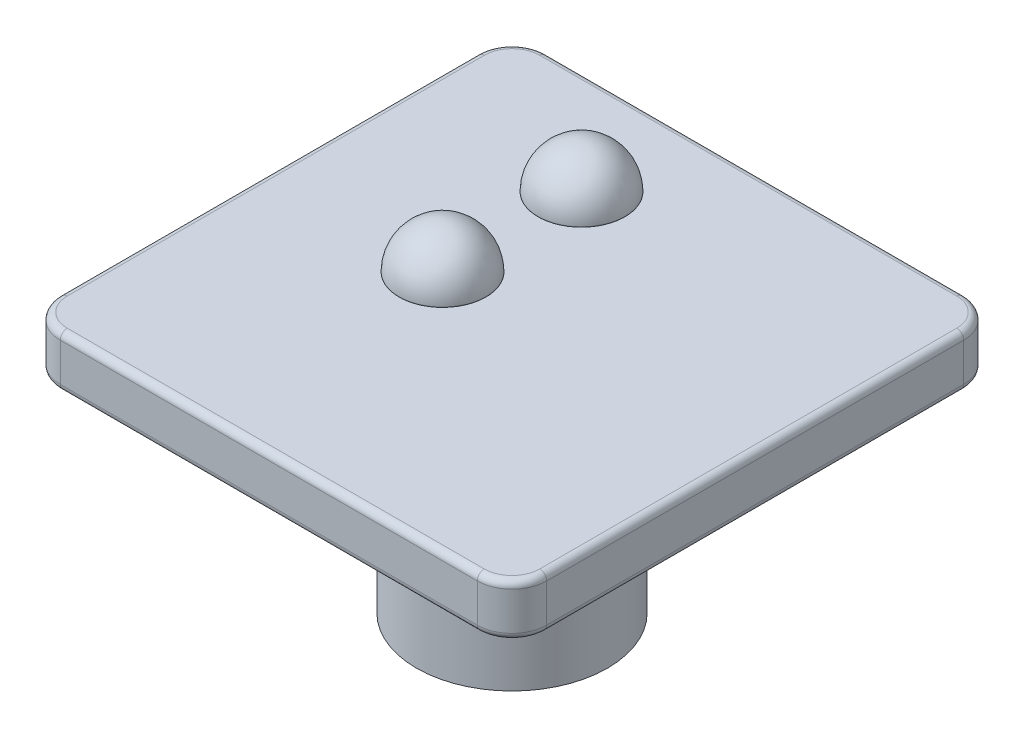
from build123d import *

# Parameters (mm, degrees)
BOSS_EXTRUDE1_DEPTH = 1.5
SKETCH2_R           = 2.75
BOSS_EXTRUDE2_DEPTH = 6
SKETCH3_W           = 1.1
SKETCH3_H           = 1.45
SKETCH3_W_2         = 1.45
SKETCH3_H_2         = 1.1
CUT_EXTRUDE1_DEPTH  = 6
CHAMFER1_SIZE       = 0.3
FILLET1_R           = 1
SKETCH4_R           = 1.25
BOSS_EXTRUDE3_DEPTH = 0.01
DOME1_FACE_RADIUS   = 1.25
DOME1_HEIGHT        = 1.25
DOME3_FACE_RADIUS   = 1.25
DOME3_HEIGHT        = 1.25
FILLET3_R           = 0.2


with BuildPart() as part:
    # Sketch1 → Boss-Extrude1 (new body)
    with BuildSketch(Plane(origin=(0, 0, 0), x_dir=(1, 0, 0), z_dir=(0, 1, 0))):
        with BuildLine():
            Line((-7.324675649, 4.396717546), (4.675324351, 4.396717546))
            ThreePointArc((4.675324351, 4.396717546), (5.382431132, 4.103824327), (5.675324351, 3.396717546))
            Line((5.675324351, 3.396717546), (5.675324351, -8.603282454))
            ThreePointArc((5.675324351, -8.603282454), (5.382431132, -9.310389235), (4.675324351, -9.603282454))
            Line((4.675324351, -9.603282454), (-7.324675649, -9.603282454))
            ThreePointArc((-7.324675649, -9.603282454), (-8.03178243, -9.310389235), (-8.324675649, -8.603282454))
            Line((-8.324675649, -8.603282454), (-8.324675649, 3.396717546))
            ThreePointArc((-8.324675649, 3.396717546), (-8.03178243, 4.103824327), (-7.324675649, 4.396717546))
        make_face()
    extrude(amount=BOSS_EXTRUDE1_DEPTH)

    # Sketch2 → Boss-Extrude2 (add)
    with BuildSketch(Plane.XZ):
        with Locations(Location((-1.324675649, 2.603282454, 0), (0, 0, 270))):
            Circle(SKETCH2_R)
    extrude(amount=BOSS_EXTRUDE2_DEPTH)

    # Sketch3 → Cut-Extrude1 (cut)
    with BuildSketch(Plane.XZ.offset(6)):
        with Locations((-1.324675649, 3.878282454)):
            Rectangle(SKETCH3_W, SKETCH3_H)
        with Locations((-0.049675649, 2.603282454)):
            Rectangle(SKETCH3_W_2, SKETCH3_H_2)
        with Locations((-1.324675649, 2.603282454)):
            Rectangle(SKETCH3_W, SKETCH3_H_2)
        with Locations((-2.599675649, 2.603282454)):
            Rectangle(SKETCH3_W_2, SKETCH3_H_2)
        with Locations((-1.324675649, 1.328282454)):
            Rectangle(SKETCH3_W, SKETCH3_H)
    extrude(amount=-CUT_EXTRUDE1_DEPTH, mode=Mode.SUBTRACT)

    # Chamfer1
    chamfer1_edges = [part.edges().sort_by_distance(p)[0] for p in [
        (-0.774675649, -6, 3.878282454),
        (-0.049675649, -6, 3.153282454),
        (0.675324351, -6, 2.603282454),
        (-0.774675649, -6, 1.328282454),
        (-2.599675649, -6, 3.153282454),
        (-1.324675649, -6, 4.603282454),
        (-1.874675649, -6, 3.878282454),
        (-3.324675649, -6, 2.603282454),
        (-2.599675649, -6, 2.053282454),
        (-1.874675649, -6, 1.328282454),
        (-1.324675649, -6, 0.603282454),
        (-0.049675649, -6, 2.053282454),
    ]]
    chamfer(chamfer1_edges, length=CHAMFER1_SIZE)

    # Fillet1
    fillet1_edges = [part.edges().sort_by_distance(p)[0] for p in [
        (-1.324675649, 0, 5.353282454),
    ]]
    fillet(fillet1_edges, radius=FILLET1_R)

    # Sketch4 → Boss-Extrude3 (add)
    with BuildSketch(Plane(origin=(0, 1.5, 0), x_dir=(1, 0, 0), z_dir=(0, 1, 0))):
        with Locations(Location((-3.324675649, 1.396717546, 0), (0, 0, 90))):
            Circle(SKETCH4_R)
        with Locations(Location((-3.324675649, -2.603282454, 0), (0, 0, 90))):
            Circle(SKETCH4_R)
    extrude(amount=BOSS_EXTRUDE3_DEPTH)

    # Dome1: a dome of height H over a round flat face of radius A is a cap of a sphere of radius (A * A + H * H) / (2 * H)
    dome1_r = (DOME1_FACE_RADIUS * DOME1_FACE_RADIUS + DOME1_HEIGHT * DOME1_HEIGHT) / (2 * DOME1_HEIGHT)
    dome1_base = Plane((-3.324675649, 1.51, -1.396717546), z_dir=(0, 1, 0))
    with Locations(dome1_base.offset(DOME1_HEIGHT - dome1_r)):
        dome1_ball = Sphere(dome1_r, mode=Mode.PRIVATE)
    add(split(dome1_ball, bisect_by=dome1_base, keep=Keep.TOP, mode=Mode.PRIVATE))

    # Dome3: a dome of height H over a round flat face of radius A is a cap of a sphere of radius (A * A + H * H) / (2 * H)
    dome3_r = (DOME3_FACE_RADIUS * DOME3_FACE_RADIUS + DOME3_HEIGHT * DOME3_HEIGHT) / (2 * DOME3_HEIGHT)
    dome3_base = Plane((-3.324675649, 1.51, 2.603282454), z_dir=(0, 1, 0))
    with Locations(dome3_base.offset(DOME3_HEIGHT - dome3_r)):
        dome3_ball = Sphere(dome3_r, mode=Mode.PRIVATE)
    add(split(dome3_ball, bisect_by=dome3_base, keep=Keep.TOP, mode=Mode.PRIVATE))

    # Fillet3
    fillet3_edges = [part.edges().sort_by_distance(p)[0] for p in [
        (5.382431132, 1.5, 9.310389235),
        (-1.324675649, 0, 9.603282454),
        (-8.03178243, 0, 9.310389235),
        (5.675324351, 1.5, 2.603282454),
        (5.382431132, 1.5, -4.103824327),
        (-1.324675649, 1.5, -4.396717546),
        (-8.03178243, 1.5, -4.103824327),
        (-8.324675649, 1.5, 2.603282454),
        (-8.03178243, 1.5, 9.310389235),
        (-1.324675649, 1.5, 9.603282454),
        (-8.324675649, 0, 2.603282454),
        (-8.03178243, 0, -4.103824327),
        (-1.324675649, 0, -4.396717546),
        (5.382431132, 0, -4.103824327),
        (5.675324351, 0, 2.603282454),
        (5.382431132, 0, 9.310389235),
    ]]
    fillet(fillet3_edges, radius=FILLET3_R)


solid = part.part
